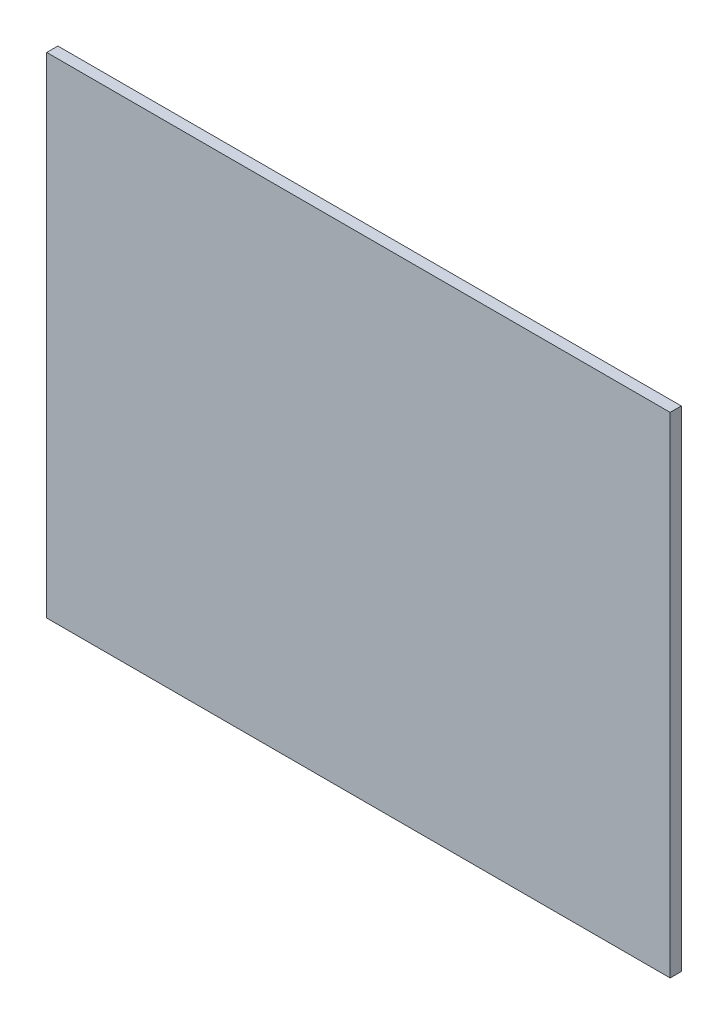
from build123d import *

# Parameters (mm, degrees)
SKETCH1_W           = 355.6
SKETCH1_H           = 279.4
BOSS_EXTRUDE1_DEPTH = 6.35


with BuildPart() as part:
    # Sketch1 → Boss-Extrude1 (new body)
    with BuildSketch(Plane.XY):
        Rectangle(SKETCH1_W, SKETCH1_H)
    extrude(amount=BOSS_EXTRUDE1_DEPTH)


solid = part.part
